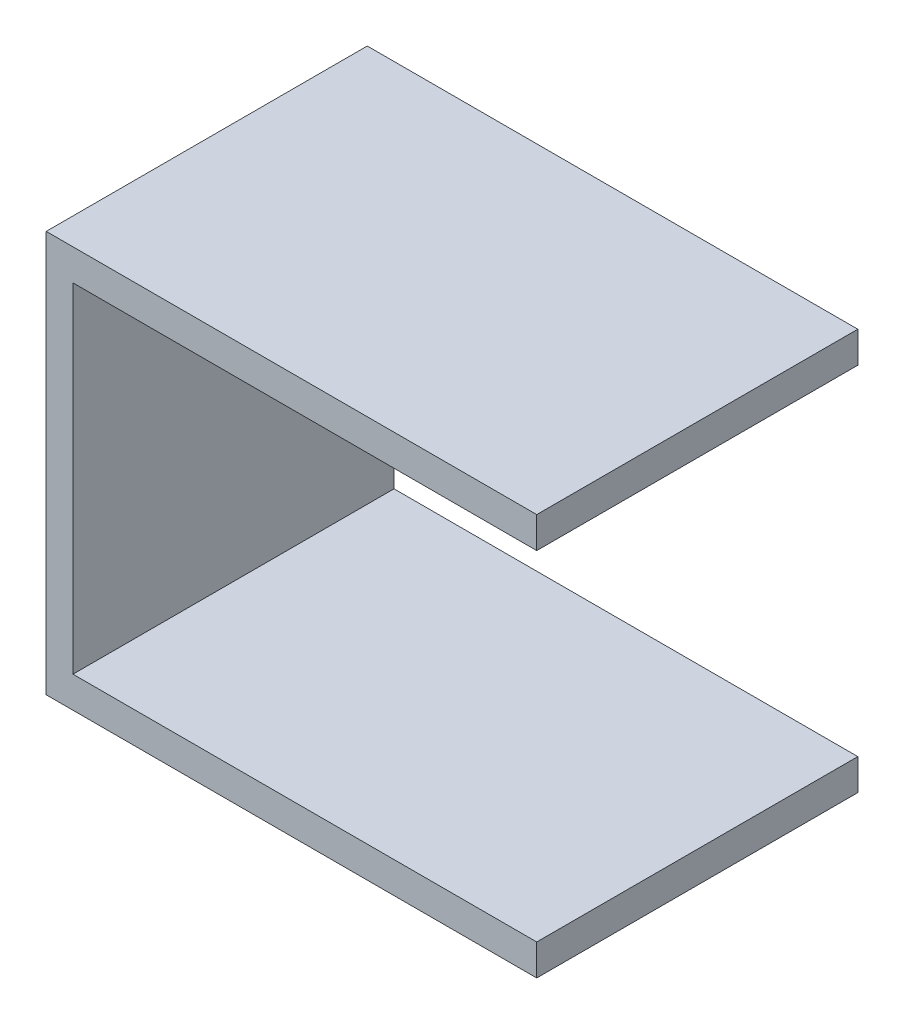
from build123d import *

# Parameters (mm, degrees)
BOSS_EXTRUDE1_DEPTH = 36


with BuildPart() as part:
    # Sketch2 → Boss-Extrude1 (new body)
    with BuildSketch(Plane.XY):
        Polygon((0, 0), (52, 0), (52, 3.5), (0, 3.5), (0, 41.5), (52, 41.5), (52, 45), (-3, 45), (-3, 0), align=None)
    extrude(amount=BOSS_EXTRUDE1_DEPTH)


solid = part.part
